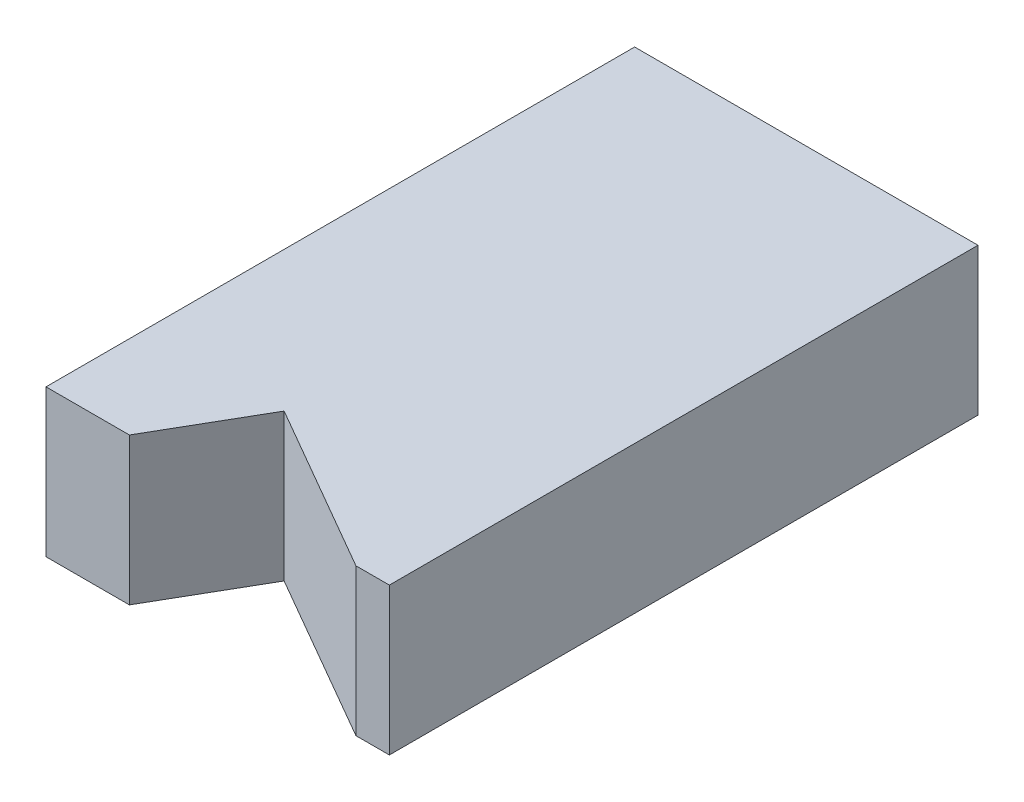
from build123d import *

# Parameters (mm, degrees)
SKETCH2_W               = 101.6
SKETCH2_H               = 50.8
BOSS_EXTRUDE1_DEPTH     = 152.4
CUT_EXTRUDE1_DEPTH      = 191.076195248
CUT_EXTRUDE1_DEPTH_BACK = 191.076195248
CUT_EXTRUDE2_DEPTH      = 191.076195248
CUT_EXTRUDE2_DEPTH_BACK = 191.076195248
SKETCH4_W               = 67.31
SKETCH4_H               = 12.7


with BuildPart() as part:
    # Sketch2 → Boss-Extrude1 (new body)
    with BuildSketch(Plane.XY):
        with Locations((50.8, 25.4)):
            Rectangle(SKETCH2_W, SKETCH2_H)
    extrude(amount=BOSS_EXTRUDE1_DEPTH)

    # Sketch3 → Cut-Extrude1 (cut, two sides: drawn at the far end of the back side and taken through both)
    with BuildSketch(Plane.XZ.offset(-CUT_EXTRUDE1_DEPTH_BACK)):
        Polygon((-149.218366946, 470.245815165), (34.29, 152.4), (48.954696837, 127), (92.94878735, 152.4), (410.794602514, 335.908366946), (582.019022435, 1049.69217865), (22.006052975, 1184.029626869), align=None)
    extrude(amount=CUT_EXTRUDE1_DEPTH + CUT_EXTRUDE1_DEPTH_BACK, mode=Mode.SUBTRACT)

    # Sketch4 → Cut-Extrude2 (cut, two sides: drawn at the far end of the back side and taken through both)
    with BuildSketch(Plane.XY.offset(152.4).offset(-CUT_EXTRUDE2_DEPTH_BACK)):
        Polygon((0, 0), (12.7, 0), (12.7, 38.1), (34.29, 38.1), (34.29, 50.8), (0, 50.8), align=None)
        with Locations((67.945, 44.45)):
            Rectangle(SKETCH4_W, SKETCH4_H)
    extrude(amount=CUT_EXTRUDE2_DEPTH + CUT_EXTRUDE2_DEPTH_BACK, mode=Mode.SUBTRACT)


solid = part.part
